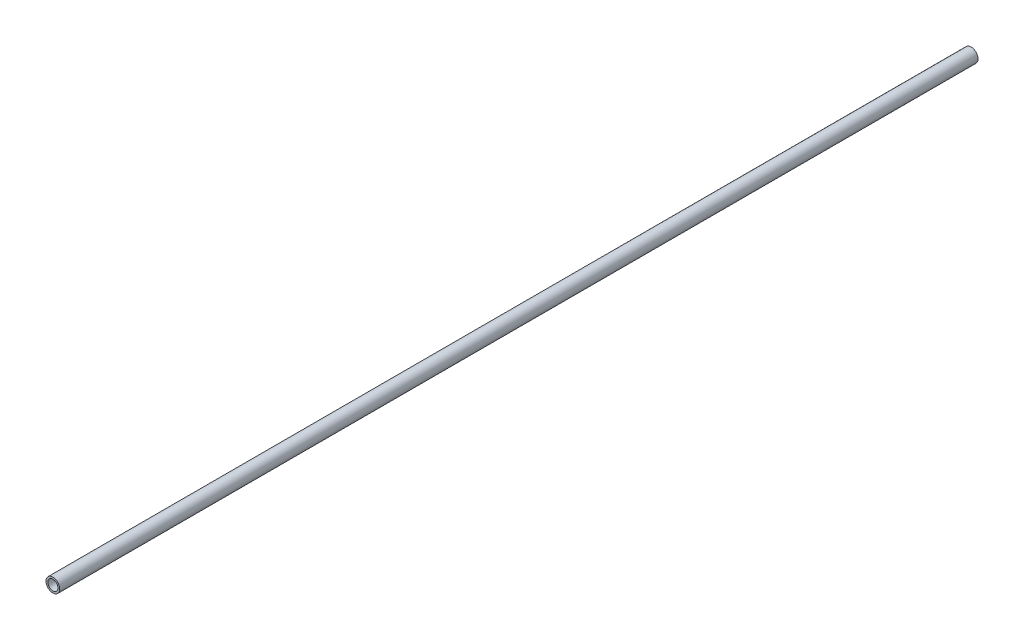
from build123d import *

# Parameters (mm, degrees)
SKETCH1_R           = 3.75
SKETCH1_R_2         = 2.75
BOSS_EXTRUDE1_DEPTH = 500


with BuildPart() as part:
    # Sketch1 → Boss-Extrude1 (new body)
    with BuildSketch(Plane.XY):
        with Locations((-32.899281496, 249.847725303)):
            Circle(SKETCH1_R)
        with Locations((-32.899281496, 249.847725303)):
            Circle(SKETCH1_R_2, mode=Mode.SUBTRACT)
    extrude(amount=BOSS_EXTRUDE1_DEPTH)


solid = part.part
